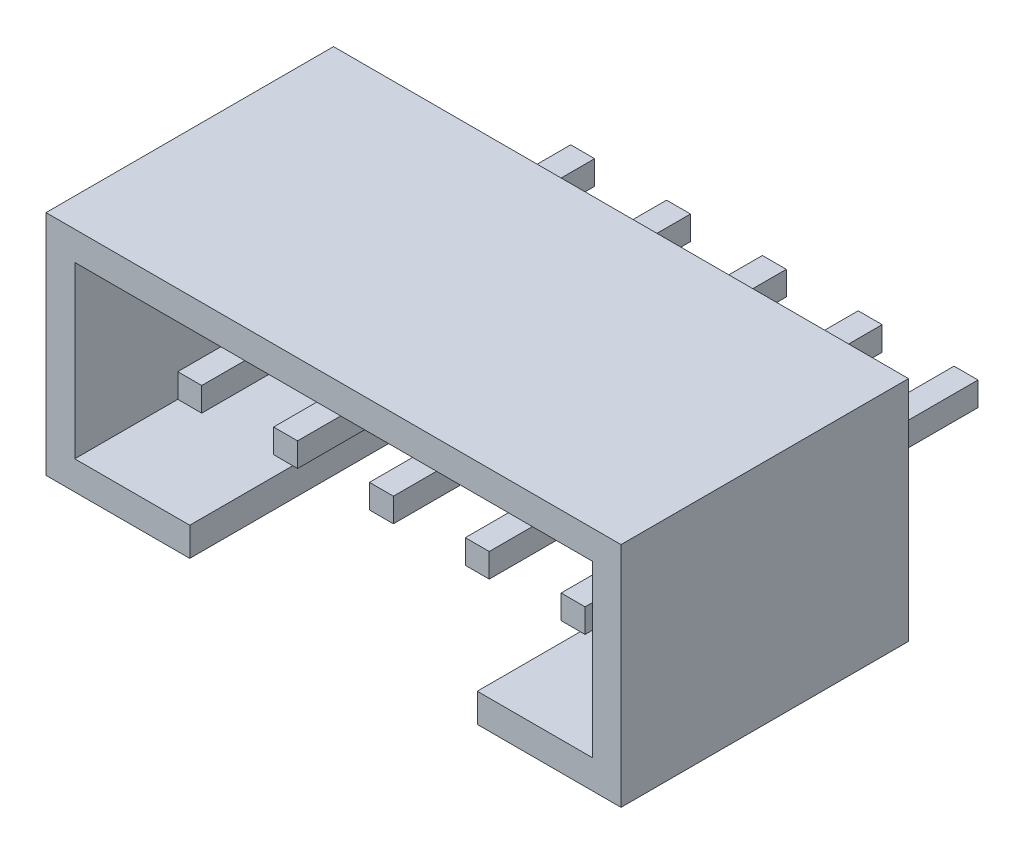
from build123d import *

# Parameters (mm, degrees)
SKETCH1_W           = 12
SKETCH1_H           = 4.75
BOSS_EXTRUDE1_DEPTH = 1.8
BOSS_EXTRUDE2_DEPTH = 4.2
BOSS_EXTRUDE3_START = -5
SKETCH3_W           = 0.5
SKETCH3_H           = 0.5
BOSS_EXTRUDE3_DEPTH = 8.2
LPATTERN1_COUNT     = 5
LPATTERN1_PITCH     = 2


with BuildPart() as part:
    # Sketch1 → Boss-Extrude1 (new body)
    with BuildSketch(Plane.XY):
        Rectangle(SKETCH1_W, SKETCH1_H)
    extrude(amount=BOSS_EXTRUDE1_DEPTH)

    # Sketch2 → Boss-Extrude2 (add)
    with BuildSketch(Plane.XY.offset(1.8)):
        Polygon((-3, -2.375), (-3, -1.775), (-5.4, -1.775), (-5.4, 1.775), (5.4, 1.775), (5.4, -1.775), (3, -1.775), (3, -2.375), (6, -2.375), (6, 2.375), (-6, 2.375), (-6, -2.375), align=None)
    extrude(amount=BOSS_EXTRUDE2_DEPTH)

    # Sketch3 → Boss-Extrude3 (add)
    with BuildSketch(Plane.XY.offset(1.8).offset(BOSS_EXTRUDE3_START)):
        with Locations((-4, -0.375)):
            Rectangle(SKETCH3_W, SKETCH3_H)
    boss_extrude3 = extrude(amount=BOSS_EXTRUDE3_DEPTH)

    # LPattern1: Boss-Extrude3 ×5
    with Locations(*[(i * LPATTERN1_PITCH, 0, 0) for i in range(1, LPATTERN1_COUNT)]):
        add(boss_extrude3)


solid = part.part
